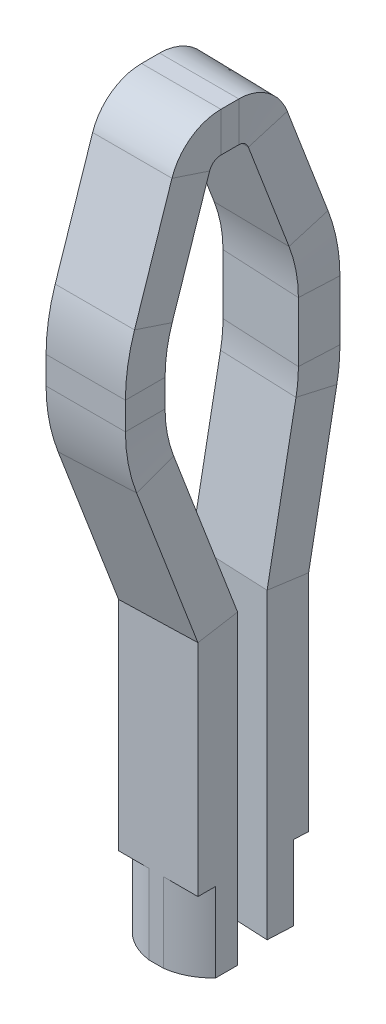
from build123d import *

# Parameters (mm, degrees)
CROQUIS2_W              = 5
CROQUIS2_H              = 2.5
SALIENTE_EXTRUIR1_DEPTH = 5
CROQUIS3_W              = 5
CROQUIS3_H              = 2.5
CROQUIS5_R              = 8.815578543
CROQUIS5_R_2            = 3.599245637
CORTAR_EXTRUIR2_DEPTH   = 5


with BuildPart() as part:
    # Croquis2 → Saliente-Extruir1 (new body)
    with BuildSketch(Plane(origin=(0, 0, 0), x_dir=(1, 0, 0), z_dir=(0, 1, 0))):
        with Locations((2.5, -1.25)):
            Rectangle(CROQUIS2_W, CROQUIS2_H)
    extrude(amount=SALIENTE_EXTRUIR1_DEPTH)

    # Barrer1: sweep along a curve in space
    with BuildLine() as barrer1_path:
        Line((2.5, 5, 1.25), (2.5, 19, 1.25))
        Line((2.5, 19, 1.25), (1.936029021, 28.678970963, 4.604923122))
        ThreePointArc((1.936029021, 28.678970963, 4.604923122), (1.865851519, 30.312993123, 5.022391631), (1.842234719, 31.994937811, 5.162882101))
        Line((1.842234719, 31.994937811, 5.162882101), (1.842234719, 33.722348676, 5.162882101))
        ThreePointArc((1.842234719, 33.722348676, 5.162882101), (1.842234719, 35.320455068, 5.034358989), (1.842234719, 36.877482738, 4.652093293))
        Line((1.842234719, 36.877482738, 4.652093293), (1.842234719, 43.97230449, 2.293086488))
        ThreePointArc((1.842234719, 43.97230449, 2.293086488), (1.842234719, 44.9633217, 1.565275526), (1.842234719, 45.341277677, 0.39524425))
        Line((1.842234719, 45.341277677, 0.39524425), (1.842234719, 45.341277677, -0.73780457))
        ThreePointArc((1.842234719, 45.341277677, -0.73780457), (1.863808704, 44.971021079, -1.897969648), (1.920529201, 43.997573754, -2.627847367))
        Line((1.920529201, 43.997573754, -2.627847367), (2.289449651, 37.666094909, -4.822463391))
        ThreePointArc((2.289449651, 37.666094909, -4.822463391), (2.359627153, 36.032072749, -5.2399319), (2.383243953, 34.350128061, -5.38042237))
        Line((2.383243953, 34.350128061, -5.38042237), (2.383243953, 30.584429951, -5.38042237))
        ThreePointArc((2.383243953, 30.584429951, -5.38042237), (2.383243953, 29.650386796, -5.336704979), (2.383243953, 28.724510426, -5.205935047))
        Line((2.383243953, 28.724510426, -5.205935047), (2.383243953, 19.234217455, -3.409470905))
        Line((2.383243953, 19.234217455, -3.409470905), (2.383243953, 0.279197945, -3.409470905))
    # Croquis3 → Barrer1 (sweep)
    with BuildSketch(Plane(origin=(0, 5, 0), x_dir=(1, 0, 0), z_dir=(0, 1, 0))):
        with Locations((2.5, -1.25)):
            Rectangle(CROQUIS3_W, CROQUIS3_H)
    sweep(path=barrer1_path.line, transition=Transition.RIGHT)

    # Croquis5 → Cortar-Extruir2 (cut)
    with BuildSketch(Plane.XZ):
        with Locations((2.369192746, -1.070116094)):
            Circle(CROQUIS5_R)
        with Locations((2.369192746, -1.070116094)):
            Circle(CROQUIS5_R_2, mode=Mode.SUBTRACT)
    extrude(amount=-CORTAR_EXTRUIR2_DEPTH, mode=Mode.SUBTRACT)


solid = part.part
